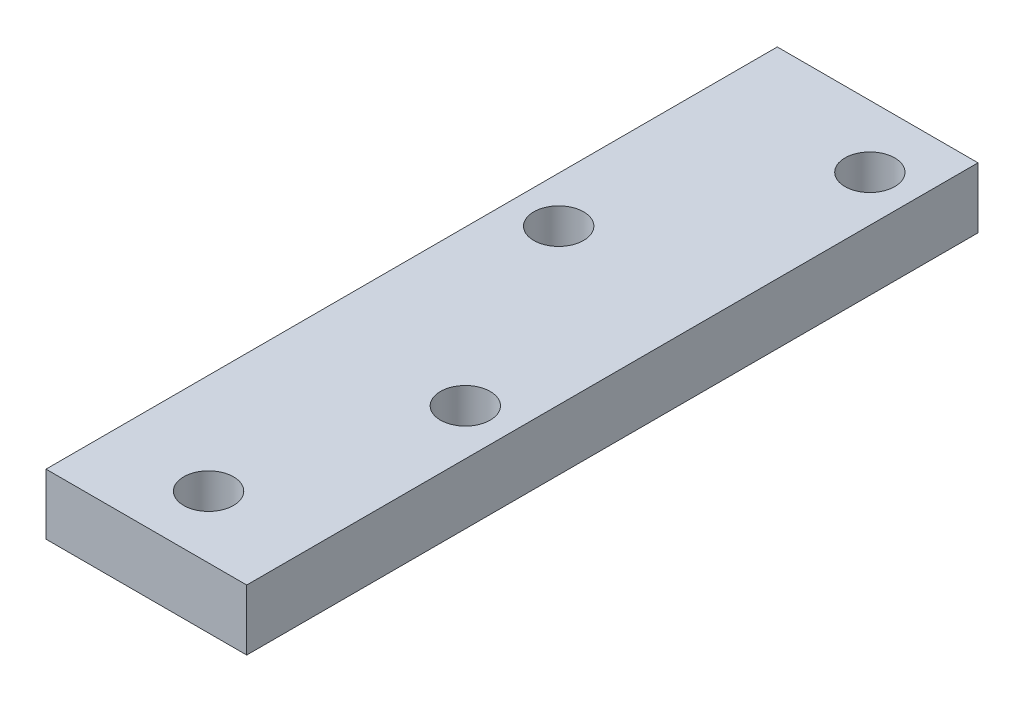
from build123d import *

# Parameters (mm, degrees)
SKETCH_1_W          = 7.5
SKETCH_1_H          = 6
EXTRUDE_1_DEPTH     = 2
SKETCH_2_W          = 12.9
SKETCH_2_H          = 3.9
EXTRUDE_2_DEPTH     = 52
SKETCH_3_R          = 1.6
CUT_EXTRUDE_1_DEPTH = 356
SKETCH_4_W          = 7.5
SKETCH_4_H          = 1.05
CUT_EXTRUDE_2_DEPTH = 10
SKETCH_5_W          = 22.28550744
SKETCH_5_H          = 23.147494016
CUT_EXTRUDE_3_DEPTH = 10


with BuildPart() as part:
    # 草图1 → 凸台-拉伸1 (new body)
    with BuildSketch(Plane.XY):
        with Locations((3.75, 0)):
            Rectangle(SKETCH_1_W, SKETCH_1_H)
    extrude(amount=EXTRUDE_1_DEPTH)

    # 草图2 → 凸台-拉伸2 (add)
    with BuildSketch(Plane.XY.offset(2)):
        Rectangle(SKETCH_2_W, SKETCH_2_H)
    extrude(amount=EXTRUDE_2_DEPTH)

    # 草图3 → 切除-拉伸1 (cut)
    with BuildSketch(Plane.XZ.offset(1.95)):
        with Locations((3.5, 37)):
            Circle(SKETCH_3_R)
        with Locations((3.5, 11)):
            Circle(SKETCH_3_R)
        with Locations((-3.5, 24)):
            Circle(SKETCH_3_R)
        with Locations((0, 50)):
            Circle(SKETCH_3_R)
    extrude(amount=-CUT_EXTRUDE_1_DEPTH, mode=Mode.SUBTRACT)

    # 草图4 → 切除-拉伸2 (cut)
    with BuildSketch(Plane.XY.offset(2)):
        with Locations((3.75, 2.475)):
            Rectangle(SKETCH_4_W, SKETCH_4_H)
    extrude(amount=-CUT_EXTRUDE_2_DEPTH, mode=Mode.SUBTRACT)

    # 草图5 → 切除-拉伸3 (cut)
    with BuildSketch(Plane(origin=(0, 1.95, 0), x_dir=(1, 0, 0), z_dir=(0, 1, 0))):
        with Locations((0, 4.573747008)):
            Rectangle(SKETCH_5_W, SKETCH_5_H)
    extrude(amount=-CUT_EXTRUDE_3_DEPTH, mode=Mode.SUBTRACT)


solid = part.part
